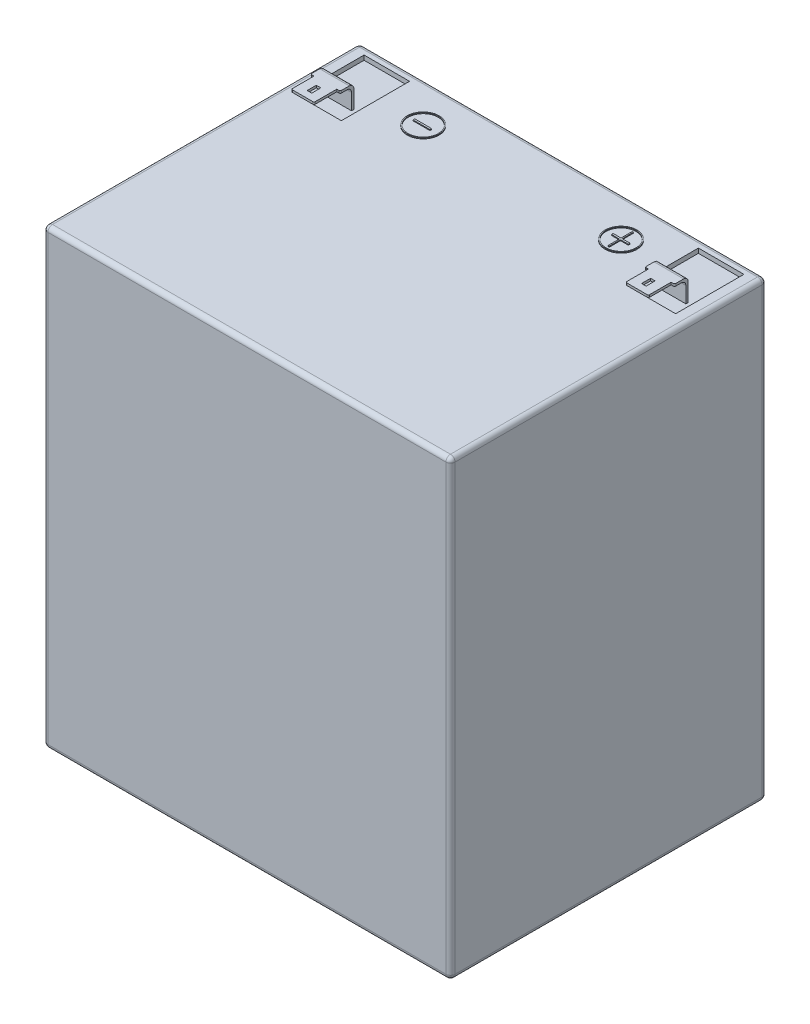
from build123d import *

# Parameters (mm, degrees)
SKETCH_1_W             = 89.5
SKETCH_1_H             = 69.5
EXTRUDE_1_DEPTH        = 99.5
SKETCH_2_W             = 10
SKETCH_2_H             = 15
CUT_EXTRUDE_1_DEPTH    = 1
FILLET_1_R             = 1
SKETCH_3_W             = 6.5
SKETCH_3_H             = 0.5
EXTRUDE_2_DEPTH        = 5
SKETCH_4_W             = 1
SKETCH_4_H             = 2
EXTRUDE_3_DEPTH        = 0.5
FILLET_2_R             = 1
FILLET_3_R             = 0.3
FILLET_2_OF_MIRROR_1_R = 1
FILLET_3_OF_MIRROR_1_R = 0.3
SKETCH_5_W             = 3.710206691
SKETCH_5_H             = 0.372043469
EXTRUDE_4_DEPTH        = 0.2
SKETCH_6_R             = 3.5
SKETCH_6_R_2           = 3.3
EXTRUDE_5_DEPTH        = 0.2


with BuildPart() as part:
    # 草图1 → 凸台-拉伸1 (new body)
    with BuildSketch(Plane(origin=(0, 0, 0), x_dir=(1, 0, 0), z_dir=(0, 1, 0))):
        Rectangle(SKETCH_1_W, SKETCH_1_H)
    extrude(amount=EXTRUDE_1_DEPTH)

    # 草图2 → 切除-拉伸1 (cut)
    with BuildSketch(Plane(origin=(0, 99.5, 0), x_dir=(1, 0, 0), z_dir=(0, 1, 0))):
        with Locations((-36.75, 25.25)):
            Rectangle(SKETCH_2_W, SKETCH_2_H)
        with Locations((36.75, 25.25)):
            Rectangle(SKETCH_2_W, SKETCH_2_H)
    extrude(amount=-CUT_EXTRUDE_1_DEPTH, mode=Mode.SUBTRACT)

    # 圆角1
    fillet_1_edges = [part.edges().sort_by_distance(p)[0] for p in [
        (-44.75, 99.5, 0),
        (0, 99.5, 34.75),
        (44.75, 99.5, 0),
        (0, 0, 34.75),
        (-44.75, 0, 0),
        (0, 0, -34.75),
        (44.75, 0, 0),
        (0, 99.5, -34.75),
        (44.75, 49.75, 34.75),
        (-44.75, 49.75, 34.75),
        (-44.75, 49.75, -34.75),
        (44.75, 49.75, -34.75),
    ]]
    fillet(fillet_1_edges, radius=FILLET_1_R)

    # 草图3 → 凸台-拉伸2 (add)
    with BuildSketch(Plane(origin=(0, 98.5, 0), x_dir=(1, 0, 0), z_dir=(0, 1, 0))):
        with Locations((36.75, 22)):
            Rectangle(SKETCH_3_W, SKETCH_3_H)
    extrude_2 = extrude(amount=EXTRUDE_2_DEPTH)

    # 草图4 → 凸台-拉伸3 (add)
    with BuildSketch(Plane(origin=(0, 103.5, 0), x_dir=(1, 0, 0), z_dir=(0, 1, 0))):
        Polygon((33.5, 21.75), (33.5, 19.25), (34.25, 19.25), (34.25, 14.25), (39.25, 14.25), (39.25, 19.25), (40, 19.25), (40, 21.75), align=None)
        with Locations((36.75, 16.75)):
            Rectangle(SKETCH_4_W, SKETCH_4_H, mode=Mode.SUBTRACT)
    extrude_3 = extrude(amount=-EXTRUDE_3_DEPTH)

    # 圆角2
    fillet_2_edges = [part.edges().sort_by_distance(p)[0] for p in [
        (36.75, 103.5, -22.25),
        (36.75, 103, -21.75),
    ]]
    fillet(fillet_2_edges, radius=FILLET_2_R)

    # 圆角3
    fillet_3_edges = [part.edges().sort_by_distance(p)[0] for p in [
        (40, 103.25, -19.25),
        (39.25, 103.25, -14.25),
        (34.25, 103.25, -14.25),
        (33.5, 103.25, -19.25),
    ]]
    fillet(fillet_3_edges, radius=FILLET_3_R)

    # 镜向1: 凸台-拉伸2, 凸台-拉伸3 across plane
    add(extrude_2.mirror(Plane(origin=(0, 0, 0), x_dir=(0, 0, 1), z_dir=(1, 0, 0))))
    add(extrude_3.mirror(Plane(origin=(0, 0, 0), x_dir=(0, 0, 1), z_dir=(1, 0, 0))))

    # 圆角2 of 镜向1
    fillet_2_of_mirror_1_edges = [part.edges().sort_by_distance(p)[0] for p in [
        (-36.75, 103.5, -22.25),
        (-36.75, 103, -21.75),
    ]]
    fillet(fillet_2_of_mirror_1_edges, radius=FILLET_2_OF_MIRROR_1_R)

    # 圆角3 of 镜向1
    fillet_3_of_mirror_1_edges = [part.edges().sort_by_distance(p)[0] for p in [
        (-40, 103.25, -19.25),
        (-39.25, 103.25, -14.25),
        (-34.25, 103.25, -14.25),
        (-33.5, 103.25, -19.25),
    ]]
    fillet(fillet_3_of_mirror_1_edges, radius=FILLET_3_OF_MIRROR_1_R)

    # 草图5 → 凸台-拉伸4 (add)
    with BuildSketch(Plane(origin=(0, 99.5, 0), x_dir=(1, 0, 0), z_dir=(0, 1, 0))):
        Polygon((21.528027711, 25.963655783), (21.528027711, 28.423489578), (21.78628469, 28.423489578), (21.78628469, 25.963655783), (23.512259546, 25.963655783), (23.512259546, 25.592890813), (21.78628469, 25.592890813), (21.78628469, 23.133057018), (21.528027711, 23.133057018), (21.528027711, 25.592890813), (19.802052855, 25.592890813), (19.802052855, 25.963655783), align=None)
        with Locations((-21.959689363, 25.792257863)):
            Rectangle(SKETCH_5_W, SKETCH_5_H)
    extrude(amount=EXTRUDE_4_DEPTH)

    # 草图6 → 凸台-拉伸5 (add)
    # profile 1 of 2: a face of its own
    with BuildSketch(Plane(origin=(0, 99.5, 0), x_dir=(1, 0, 0), z_dir=(0, 1, 0))):
        with Locations(Location((21.75, 25.75, 0), (0, 0, 90))):
            Circle(SKETCH_6_R)
        with Locations(Location((21.75, 25.75, 0), (0, 0, 270))):
            Circle(SKETCH_6_R_2, mode=Mode.SUBTRACT)
    # profile 2 of 2: a face of its own
    with BuildSketch(Plane(origin=(0, 99.5, 0), x_dir=(1, 0, 0), z_dir=(0, 1, 0))):
        with Locations(Location((-21.75, 25.75, 0), (0, 0, 90))):
            Circle(SKETCH_6_R)
        with Locations(Location((-21.75, 25.75, 0), (0, 0, 90))):
            Circle(SKETCH_6_R_2, mode=Mode.SUBTRACT)
    extrude(amount=EXTRUDE_5_DEPTH)


solid = part.part
